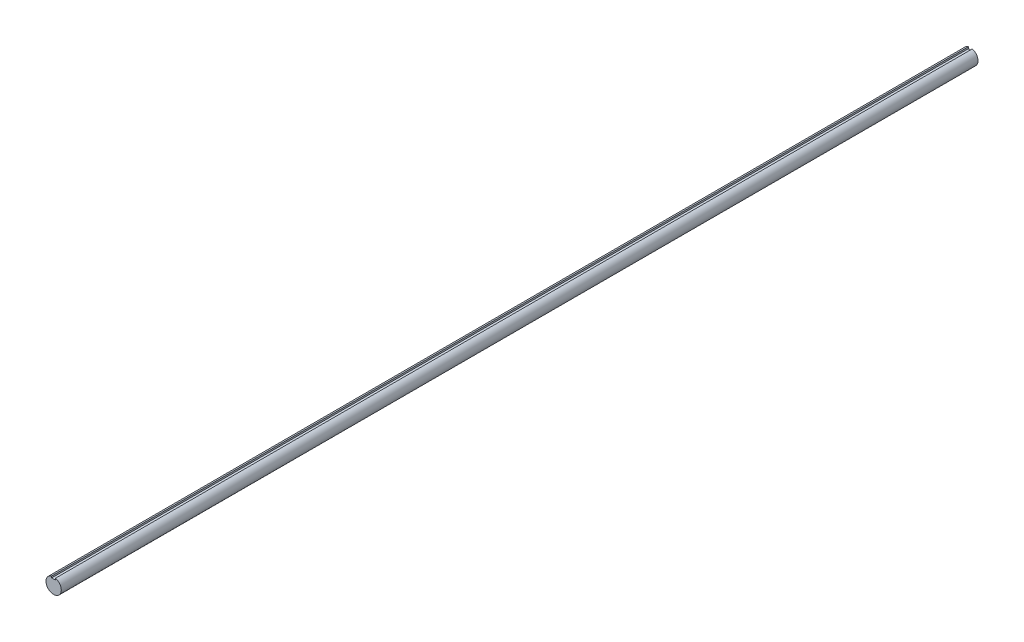
from build123d import *

# Parameters (mm, degrees)
BOSS_EXTRUDE1_DEPTH = 381


with BuildPart() as part:
    # Sketch1 → Boss-Extrude1 (new, symmetric)
    with BuildSketch(Plane.XY):
        with BuildLine():
            Line((-1.5875, 6.148361062), (-1.5875, 4.7625))
            Line((-1.5875, 4.7625), (1.5875, 4.7625))
            Line((1.5875, 4.7625), (1.5875, 6.148361062))
            ThreePointArc((1.5875, 6.148361062), (0, -6.35), (-1.5875, 6.148361062))
        make_face()
    extrude(amount=BOSS_EXTRUDE1_DEPTH, both=True)


solid = part.part
